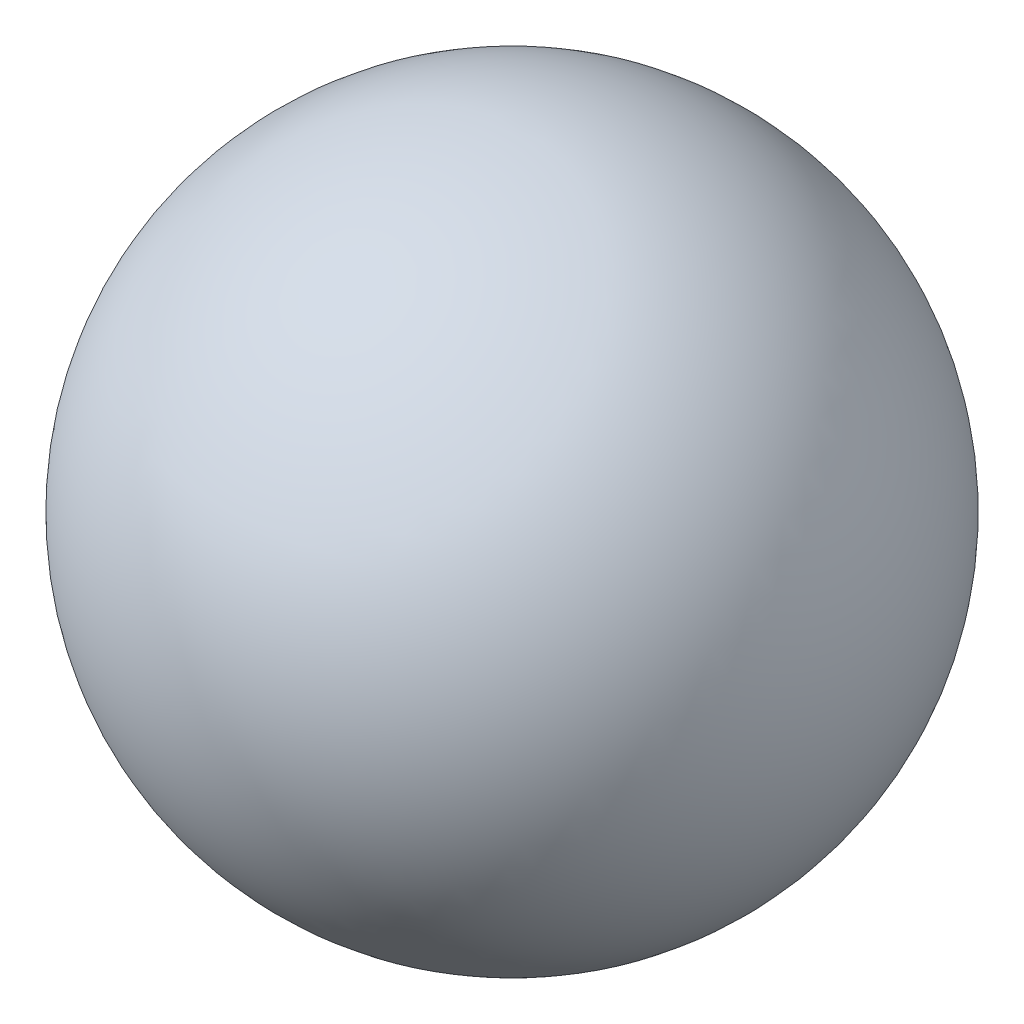
from build123d import *


with BuildPart() as part:
    # Esquisse1 → Révolution1 (revolve)
    with BuildSketch(Plane.XY):
        with BuildLine():
            Line((0, 67.3), (0, -67.3))
            ThreePointArc((0, -67.3), (-67.3, 0), (0, 67.3))
        make_face()
    revolve(axis=Axis((0, 67.3, 0), (0, -1, 0)))


solid = part.part
